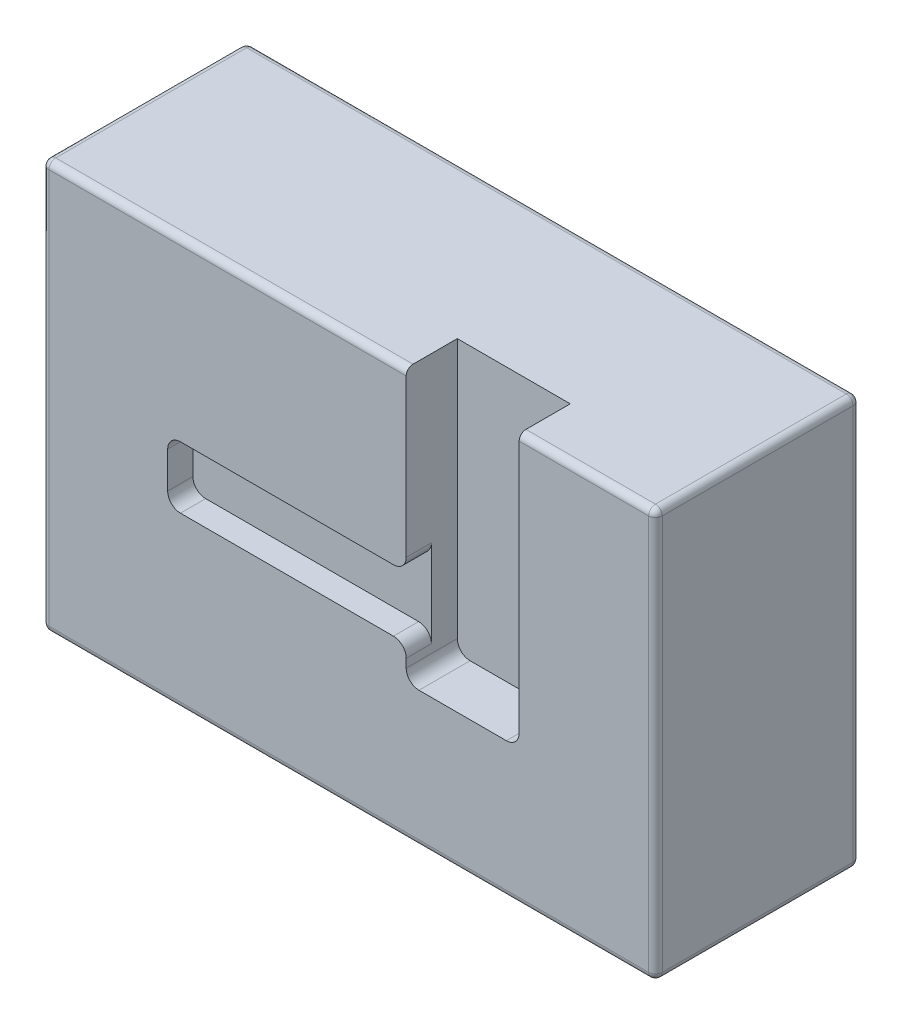
from build123d import *

# Parameters (mm, degrees)
SALIENTE_EXTRUIR1_DEPTH = 19.05
SALIENTE_EXTRUIR2_DEPTH = 38.1
CROQUIS1_5_W            = 88.9
CROQUIS1_5_H            = 19.05
SALIENTE_EXTRUIR3_DEPTH = 28.702
CROQUIS2_W              = 42.1
CROQUIS2_H              = 101.6
CORTAR_EXTRUIR1_DEPTH   = 19.05
REDONDEO1_R             = 4.7625
CROQUIS4_W              = 84.9
CROQUIS4_H              = 38.1
SALIENTE_EXTRUIR4_DEPTH = 15.05
CROQUIS5_W              = 228.6
CROQUIS5_H              = 152.4
SALIENTE_EXTRUIR5_DEPTH = 38.1
REDONDEO2_R             = 2.54
CROQUIS6_R              = 10
CORTAR_EXTRUIR2_DEPTH   = 71.2
CROQUIS7_W              = 228.6
CROQUIS7_H              = 156.90491855
CORTAR_EXTRUIR3_DEPTH   = 488.918066892


with BuildPart() as part:
    # Croquis1 → Saliente-Extruir1 (new body)
    with BuildSketch(Plane.XY):
        Polygon((0, 0), (0, 152.4), (143.7, 152.4), (143.7, 137.35), (228.6, 137.35), (228.6, 0), align=None)
    extrude(amount=SALIENTE_EXTRUIR1_DEPTH)

    # Croquis1<4> → Saliente-Extruir2 (add)
    with BuildSketch(Plane.XY):
        Polygon((0, 152.4), (0, 0), (228.6, 0), (228.6, 137.35), (143.7, 137.35), (143.7, 152.4), (92.9, 152.4), (92.9, 86.55), (181.8, 86.55), (181.8, 63.5), (92.9, 63.5), (92.9, 50.8), (50.8, 50.8), (50.8, 152.4), align=None)
    extrude(amount=SALIENTE_EXTRUIR2_DEPTH)

    # Croquis1<5> → Saliente-Extruir3 (add)
    with BuildSketch(Plane.XY):
        with Locations((135.35, 75.025)):
            Rectangle(CROQUIS1_5_W, CROQUIS1_5_H)
        Polygon((92.9, 65.5), (92.9, 63.5), (181.8, 63.5), (181.8, 86.55), (92.9, 86.55), (92.9, 84.55), (179.8, 84.55), (179.8, 65.5), align=None)
    extrude(amount=SALIENTE_EXTRUIR3_DEPTH)

    # Croquis2 → Cortar-Extruir1 (cut)
    with BuildSketch(Plane.XY.offset(38.1)):
        with Locations((71.85, 101.6)):
            Rectangle(CROQUIS2_W, CROQUIS2_H)
    extrude(amount=-CORTAR_EXTRUIR1_DEPTH, mode=Mode.SUBTRACT)

    # Redondeo1
    redondeo1_edges = [part.edges().sort_by_distance(p)[0] for p in [
        (92.9, 86.55, 33.401),
        (181.8, 86.55, 33.401),
        (181.8, 63.5, 33.401),
        (92.9, 63.5, 33.401),
        (92.9, 50.8, 28.575),
        (50.8, 50.8, 28.575),
    ]]
    fillet(redondeo1_edges, radius=REDONDEO1_R)

    # Croquis4 → Saliente-Extruir4 (add)
    with BuildSketch(Plane(origin=(0, 137.35, 0), x_dir=(1, 0, 0), z_dir=(0, 1, 0))):
        with Locations((186.15, -19.05)):
            Rectangle(CROQUIS4_W, CROQUIS4_H)
    extrude(amount=SALIENTE_EXTRUIR4_DEPTH)

    # Croquis5 → Saliente-Extruir5 (add)
    with BuildSketch(Plane(origin=(0, 0, 0), x_dir=(-1, 0, 0), z_dir=(0, 0, -1))):
        with Locations((-114.3, 76.2)):
            Rectangle(CROQUIS5_W, CROQUIS5_H)
    extrude(amount=SALIENTE_EXTRUIR5_DEPTH)

    # Redondeo2
    redondeo2_edges = [part.edges().sort_by_distance(p)[0] for p in [
        (228.6, 0, 0),
        (0, 0, 0),
        (0, 152.4, 0),
        (228.6, 152.4, 0),
        (0, 76.2, -38.1),
        (114.3, 152.4, -38.1),
        (228.6, 76.2, -38.1),
        (114.3, 0, -38.1),
        (25.4, 152.4, 38.1),
        (0, 76.2, 38.1),
        (114.3, 0, 38.1),
        (228.6, 76.2, 38.1),
        (160.75, 152.4, 38.1),
    ]]
    fillet(redondeo2_edges, radius=REDONDEO2_R)

    # Croquis6 → Cortar-Extruir2 (cut)
    with BuildSketch(Plane(origin=(0, 0, -38.1), x_dir=(-1, 0, 0), z_dir=(0, 0, -1))):
        with Locations((-25.4, 127)):
            Circle(CROQUIS6_R)
        with Locations((-203.2, 127)):
            Circle(CROQUIS6_R)
        with Locations((-203.2, 25.4)):
            Circle(CROQUIS6_R)
        with Locations((-25.4, 25.4)):
            Circle(CROQUIS6_R)
        with Locations((-114.3, 25.4)):
            Circle(CROQUIS6_R)
    extrude(amount=-CORTAR_EXTRUIR2_DEPTH, mode=Mode.SUBTRACT)

    # Simetría1: part across plane


with BuildPart() as part_1:
    add(part.part)
    add(part.part.mirror(Plane(origin=(228.6, 0, 19.05), x_dir=(0, 0, 1), z_dir=(1, 0, 0))))

    # Croquis7 → Cortar-Extruir3 (cut, through all)
    with BuildSketch(Plane.XY.offset(38.1)):
        with Locations((114.3, 78.452459275)):
            Rectangle(CROQUIS7_W, CROQUIS7_H)
    extrude(amount=-CORTAR_EXTRUIR3_DEPTH, mode=Mode.SUBTRACT)


solid = part_1.part
